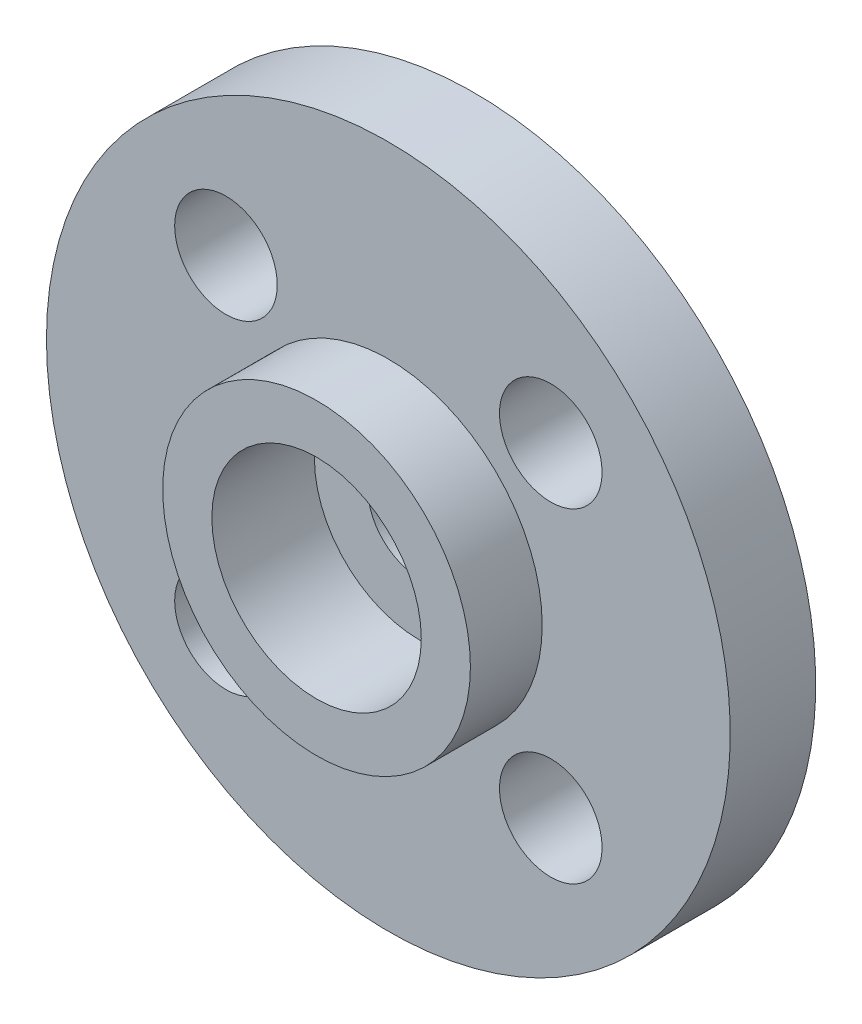
from build123d import *

# Parameters (mm, degrees)
SKETCH1_W                                          = 10
SKETCH1_H                                          = 2.5
SKETCH2_R                                          = 4.5
BOSS_EXTRUDE1_DEPTH                                = 2.1
F_3_0_3_DIAMETER_HOLE1_D                           = 3
F_3_0_3_DIAMETER_HOLE1_DEPTH                       = 4.6
CBORE_FOR_M2_5_HEX_HEAD_MACHINE_SCREW1_D           = 3
CBORE_FOR_M2_5_HEX_HEAD_MACHINE_SCREW1_CBORE_D     = 6.126092487
CBORE_FOR_M2_5_HEX_HEAD_MACHINE_SCREW1_CBORE_DEPTH = 3


with BuildPart() as part:
    # Sketch1 → Revolve1 (revolve)
    with BuildSketch(Plane.XZ, mode=Mode.PRIVATE) as revolve1_sk:
        with Locations((5, 1.25)):
            Rectangle(SKETCH1_W, SKETCH1_H)
    revolve(revolve1_sk.sketch.rotate(Axis((0, 0, 2.5), (0, 0, -1)), 180), axis=Axis((0, 0, 2.5), (0, 0, -1)))

    # Sketch2 → Boss-Extrude1 (add)
    with BuildSketch(Plane.XY.offset(2.5)):
        Circle(SKETCH2_R)
    extrude(amount=BOSS_EXTRUDE1_DEPTH)

    # Ø3.0 (3) Diameter Hole1
    with Locations(Plane(origin=(0, 0, 0), x_dir=(-1, 0, 0), z_dir=(0, 0, -1))):
        with Locations((-4.75, -4.75), (4.75, -4.75), (4.75, 4.75), (-4.75, 4.75)):
            Hole(F_3_0_3_DIAMETER_HOLE1_D / 2, depth=F_3_0_3_DIAMETER_HOLE1_DEPTH)

    # CBORE for M2.5 Hex Head Machine Screw1 (through all)
    with Locations(Plane.XY.offset(4.6)):
        with Locations((0, 0)):
            CounterBoreHole(CBORE_FOR_M2_5_HEX_HEAD_MACHINE_SCREW1_D / 2, CBORE_FOR_M2_5_HEX_HEAD_MACHINE_SCREW1_CBORE_D / 2, CBORE_FOR_M2_5_HEX_HEAD_MACHINE_SCREW1_CBORE_DEPTH)


solid = part.part
